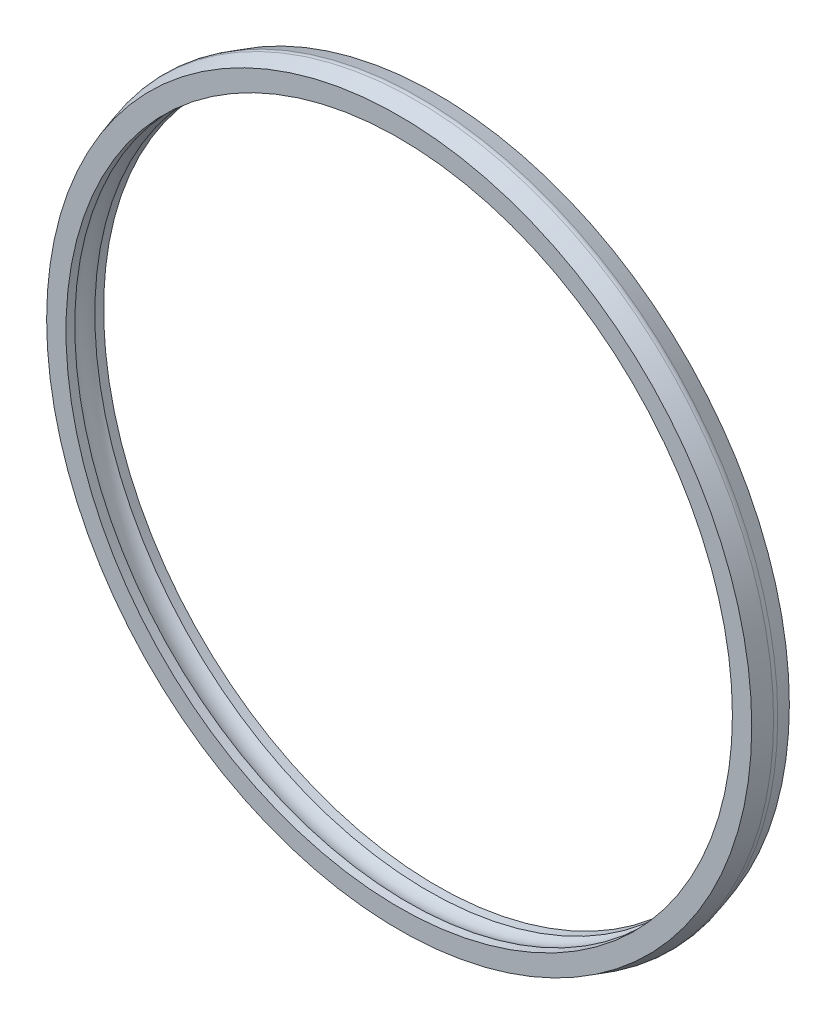
from build123d import *


with BuildPart() as part:
    # Sketch1 → Revolve1 (revolve)
    with BuildSketch(Plane(origin=(0, 0, 0), x_dir=(0, 0, -1), z_dir=(1, 0, 0)), mode=Mode.PRIVATE) as revolve1_sk:
        with BuildLine():
            Line((0.291524109, 49.911154557), (2.625, 49.2))
            Line((2.625, 49.2), (2.625, 46.5))
            Line((2.625, 46.5), (1.4, 46.5))
            ThreePointArc((1.4, 46.5), (0, 46.846700168), (-1.4, 46.5))
            Line((-1.4, 46.5), (-2.625, 46.5))
            Line((-2.625, 46.5), (-2.625, 49.2))
            Line((-2.625, 49.2), (-0.291524109, 49.911154557))
            ThreePointArc((-0.291524109, 49.911154557), (0, 49.954591076), (0.291524109, 49.911154557))
        make_face()
    revolve(revolve1_sk.sketch.rotate(Axis((0, 0, 0), (0, 0, -1)), 90), axis=Axis((0, 0, 0), (0, 0, -1)))


solid = part.part
